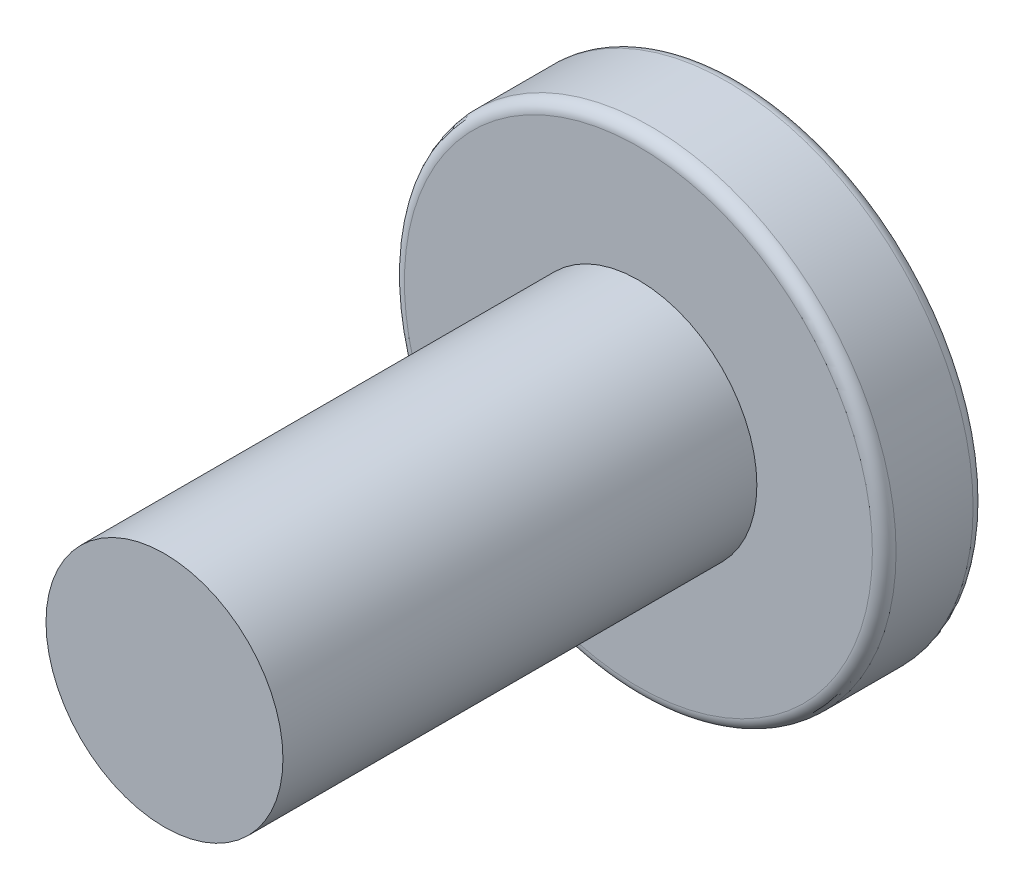
from build123d import *

# Parameters (mm, degrees)
SKETCH_1_R          = 4.15
EXTRUDE_1_DEPTH     = 1.7
SKETCH_2_R          = 2
EXTRUDE_2_DEPTH     = 8
FILLET_1_R          = 0.2
CUT_EXTRUDE_1_DEPTH = 1.5


with BuildPart() as part:
    # 草图1 → 凸台-拉伸1 (new body)
    with BuildSketch(Plane.XY):
        Circle(SKETCH_1_R)
    extrude(amount=EXTRUDE_1_DEPTH)

    # 草图2 → 凸台-拉伸2 (add)
    with BuildSketch(Plane.XY.offset(1.7)):
        Circle(SKETCH_2_R)
    extrude(amount=EXTRUDE_2_DEPTH)

    # 圆角1
    fillet_1_edges = [part.edges().sort_by_distance(p)[0] for p in [
        (-4.15, 0, 0),
        (-4.15, 0, 1.7),
    ]]
    fillet(fillet_1_edges, radius=FILLET_1_R)

    # 草图3 → 切除-拉伸1 (cut)
    with BuildSketch(Plane(origin=(0, 0, 0), x_dir=(-1, 0, 0), z_dir=(0, 0, -1))):
        Polygon((1.154700538, 0), (0.577350269, 1), (-0.577350269, 1), (-1.154700538, 0), (-0.577350269, -1), (0.577350269, -1), align=None)
    extrude(amount=-CUT_EXTRUDE_1_DEPTH, mode=Mode.SUBTRACT)


solid = part.part
